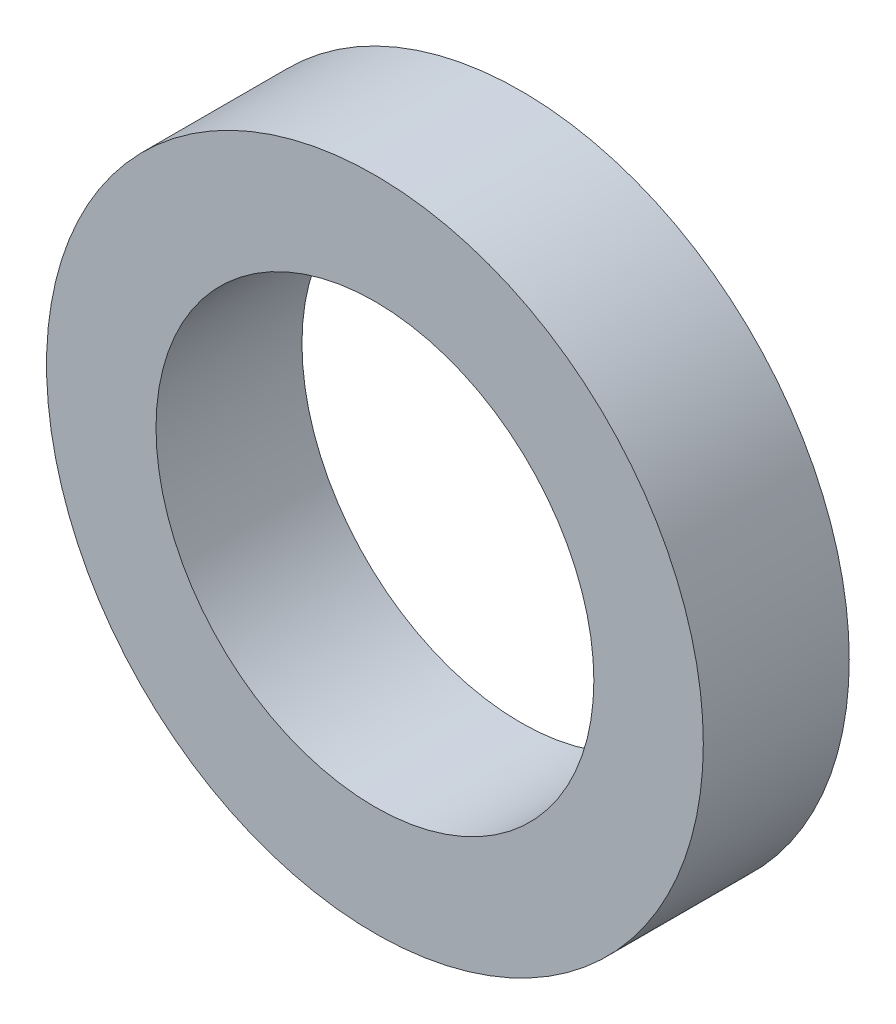
from build123d import *

# Parameters (mm, degrees)
SKETCH_1_R      = 4.5
SKETCH_1_R_2    = 3
EXTRUDE_1_DEPTH = 2


with BuildPart() as part:
    # 草图1 → 凸台-拉伸1 (new body)
    with BuildSketch(Plane.XY):
        Circle(SKETCH_1_R)
        Circle(SKETCH_1_R_2, mode=Mode.SUBTRACT)
    extrude(amount=EXTRUDE_1_DEPTH)


solid = part.part
